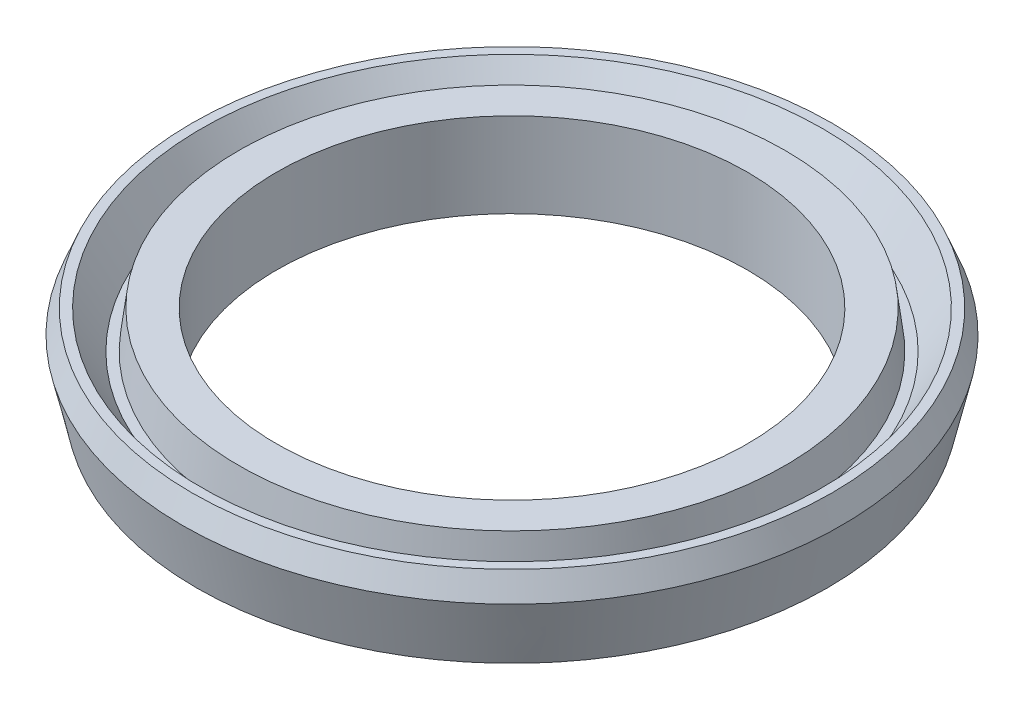
from build123d import *


with BuildPart() as part:
    # SealProfileS → SealProfile (revolve)
    with BuildSketch(Plane.XY, mode=Mode.PRIVATE) as sealprofile_sk:
        Polygon((5, 0), (5, 1.8), (5.8, 1.8), (5.9, 1), (6.1, 1), (6.6, 1.8), (6.8, 1.8), (7, 1.3), (6.7, 0), align=None)
    revolve(sealprofile_sk.sketch.rotate(Axis((0, 0, 0), (0, 1, 0)), 90), axis=Axis((0, 0, 0), (0, 1, 0)))


solid = part.part
